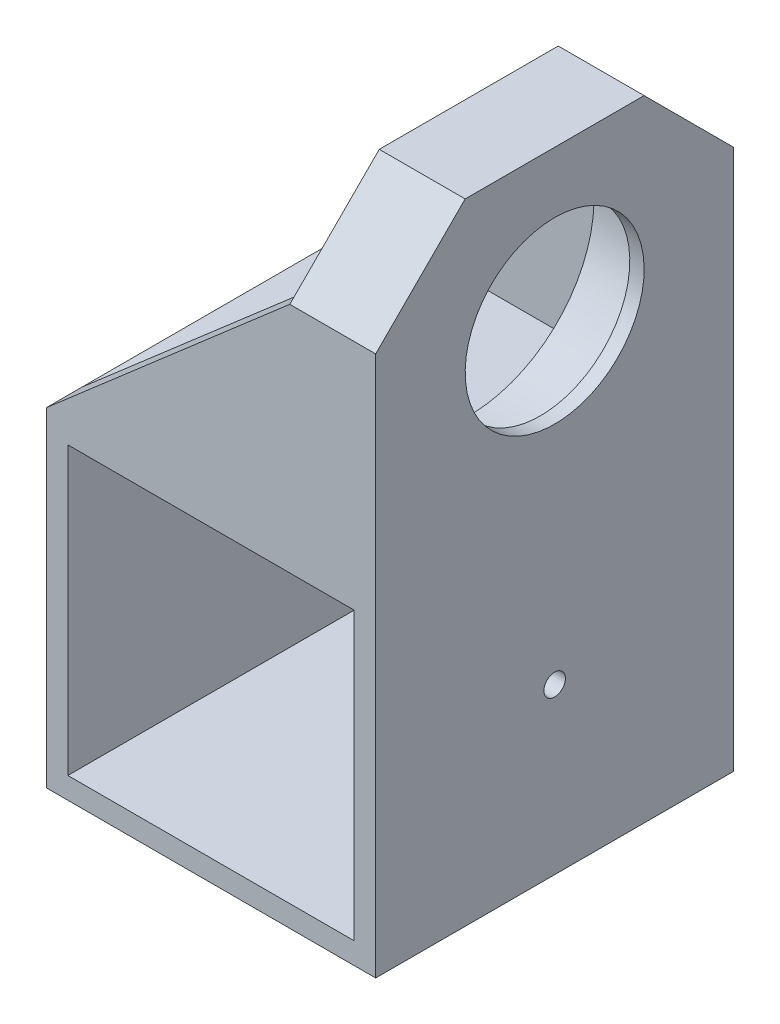
from build123d import *

# Parameters (mm, degrees)
ESQUISSE1_W             = 46
ESQUISSE1_H             = 46
ESQUISSE1_W_2           = 40
ESQUISSE1_H_2           = 40
BOSS_EXTRU_1_DEPTH      = 50
ESQUISSE8_R             = 1.5
ENL_V_MAT_EXTRU_2_DEPTH = 83.048765987
ESQUISSE9_R             = 1.5
ENL_V_MAT_EXTRU_3_DEPTH = 13.5
ESQUISSE13_R            = 17.5
BOSS_EXTRU_4_DEPTH      = 12
ESQUISSE14_R            = 17.5
ESQUISSE14_R_2          = 12.5
BOSS_EXTRU_5_DEPTH      = 2
BOSS_EXTRU_6_DEPTH      = 5
BOSS_EXTRU_7_DEPTH      = 5


with BuildPart() as part:
    # Esquisse1 → Boss.-Extru.1 (new body)
    with BuildSketch(Plane.XY):
        with Locations((-23, 23)):
            Rectangle(ESQUISSE1_W, ESQUISSE1_H)
        with Locations((-23, 23)):
            Rectangle(ESQUISSE1_W_2, ESQUISSE1_H_2, mode=Mode.SUBTRACT)
    extrude(amount=BOSS_EXTRU_1_DEPTH)

    # Esquisse8 → Enlèv. mat.-Extru.2 (cut, through all)
    with BuildSketch(Plane.ZY.offset(46)):
        with Locations((25, 23)):
            Circle(ESQUISSE8_R)
    extrude(amount=-ENL_V_MAT_EXTRU_2_DEPTH, mode=Mode.SUBTRACT)

    # Esquisse9 → Enlèv. mat.-Extru.3 (cut)
    with BuildSketch(Plane.XZ):
        with Locations((-23, 25)):
            Circle(ESQUISSE9_R)
    extrude(amount=-ENL_V_MAT_EXTRU_3_DEPTH, mode=Mode.SUBTRACT)

    # Esquisse13 → Boss.-Extru.4 (add)
    with BuildSketch(Plane(origin=(0, 0, 0), x_dir=(0, 0, -1), z_dir=(1, 0, 0))):
        Polygon((-50, 46), (-50, 75.5), (-37.5, 88), (-12.5, 88), (0, 75.5), (0, 46), align=None)
        with Locations((-25, 67)):
            Circle(ESQUISSE13_R, mode=Mode.SUBTRACT)
    extrude(amount=-BOSS_EXTRU_4_DEPTH)

    # Esquisse14 → Boss.-Extru.5 (add)
    with BuildSketch(Plane(origin=(0, 0, 0), x_dir=(0, 0, -1), z_dir=(1, 0, 0))):
        with Locations((-25, 67)):
            Circle(ESQUISSE14_R)
        with Locations((-25, 67)):
            Circle(ESQUISSE14_R_2, mode=Mode.SUBTRACT)
    extrude(amount=-BOSS_EXTRU_5_DEPTH)

    # Esquisse15 → Boss.-Extru.6 (add)
    with BuildSketch(Plane(origin=(0, 0, 0), x_dir=(-1, 0, 0), z_dir=(0, 0, -1))):
        Polygon((12, 75.5), (46, 46), (12, 46), align=None)
    extrude(amount=-BOSS_EXTRU_6_DEPTH)

    # Esquisse16 → Boss.-Extru.7 (add)
    with BuildSketch(Plane.XY.offset(50)):
        Polygon((-12, 75.5), (-46, 46), (-12, 46), align=None)
    extrude(amount=-BOSS_EXTRU_7_DEPTH)


solid = part.part
